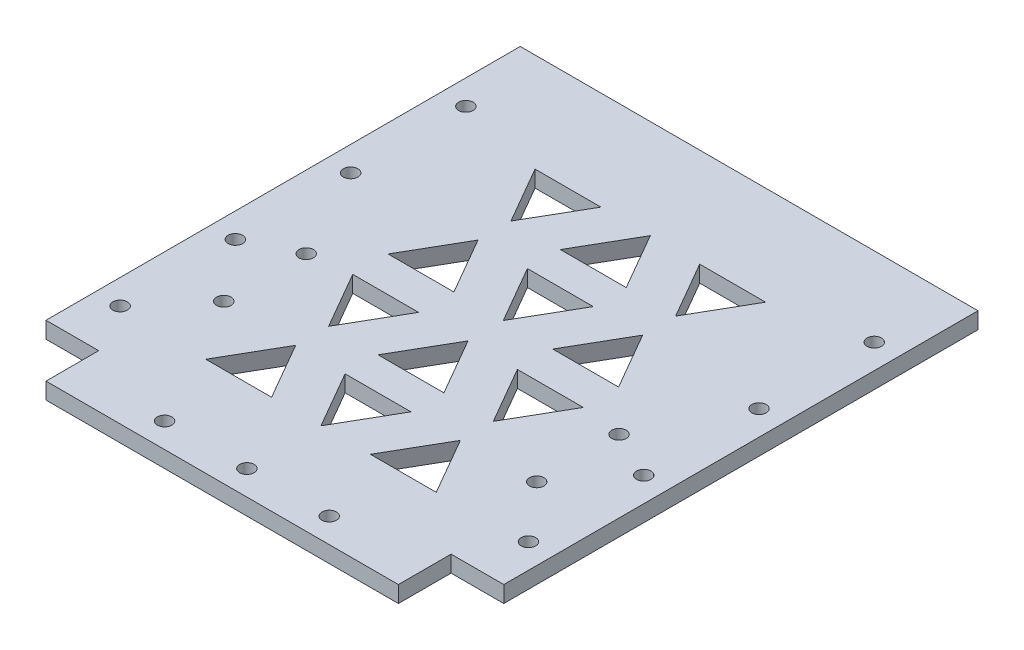
from build123d import *

# Parameters (mm, degrees)
SKETCH1_W               = 139
SKETCH1_H               = 160
BOSS_EXTRUDE1_DEPTH     = 5
SKETCH2_W               = 16
SKETCH2_H               = 16
CUT_EXTRUDE1_DEPTH      = 107.090763029
SKETCH3_R               = 2.2
CUT_EXTRUDE2_DEPTH      = 107.090763029
SKETCH4_R               = 2.2
CUT_EXTRUDE3_DEPTH      = 107.090763029
LPATTERN1_COUNT         = 4
LPATTERN1_PITCH         = 35
MIRROR2_COPY_1_SKETCH_R = 2.2
MIRROR2_COPY_1_DEPTH    = 107.090763029
MIRROR2_COPY_2_SKETCH_R = 2.2
MIRROR2_COPY_2_DEPTH    = 107.090763029
MIRROR2_COPY_3_SKETCH_R = 2.2
MIRROR2_COPY_3_DEPTH    = 107.090763029
SKETCH5_R               = 2.2
CUT_EXTRUDE4_DEPTH      = 107.090763029
CUT_EXTRUDE5_DEPTH      = 107.090763029


with BuildPart() as part:
    # Sketch1 → Boss-Extrude1 (new body)
    with BuildSketch(Plane(origin=(0, 0, 0), x_dir=(1, 0, 0), z_dir=(0, 1, 0))):
        Rectangle(SKETCH1_W, SKETCH1_H)
    extrude(amount=BOSS_EXTRUDE1_DEPTH)

    # Sketch2 → Cut-Extrude1 (cut, through all)
    with BuildSketch(Plane(origin=(0, 5, 0), x_dir=(1, 0, 0), z_dir=(0, 1, 0))):
        with Locations((-61.5, -72)):
            Rectangle(SKETCH2_W, SKETCH2_H)
    cut_extrude1 = extrude(amount=-CUT_EXTRUDE1_DEPTH, mode=Mode.SUBTRACT)

    # Mirror1: Cut-Extrude1 across plane
    add(cut_extrude1.mirror(Plane(origin=(0, 0, 0), x_dir=(0, 0, 1), z_dir=(1, 0, 0))), mode=Mode.SUBTRACT)

    # Sketch3 → Cut-Extrude2 (cut, through all)
    with BuildSketch(Plane(origin=(0, 5, 0), x_dir=(1, 0, 0), z_dir=(0, 1, 0))):
        with Locations(Location((0, -72.5, 0), (0, 0, 270))):
            Circle(SKETCH3_R)
        with Locations(Location((-25, -72.5, 0), (0, 0, 270))):
            Circle(SKETCH3_R)
        with Locations(Location((25, -72.5, 0), (0, 0, 270))):
            Circle(SKETCH3_R)
    extrude(amount=-CUT_EXTRUDE2_DEPTH, mode=Mode.SUBTRACT)

    # Sketch4 → Cut-Extrude3 (cut, through all)
    with BuildSketch(Plane(origin=(0, 5, 0), x_dir=(1, 0, 0), z_dir=(0, 1, 0))):
        with Locations(Location((-62, -49, 0), (0, 0, 270))):
            Circle(SKETCH4_R)
    cut_extrude3 = extrude(amount=-CUT_EXTRUDE3_DEPTH, mode=Mode.SUBTRACT)

    # LPattern1: Cut-Extrude3 ×4
    with Locations(*[(0, 0, -i * LPATTERN1_PITCH) for i in range(1, LPATTERN1_COUNT)]):
        add(cut_extrude3, mode=Mode.SUBTRACT)

    # Mirror2: Cut-Extrude3 across plane
    add(cut_extrude3.mirror(Plane(origin=(0, 0, 0), x_dir=(0, 0, 1), z_dir=(1, 0, 0))), mode=Mode.SUBTRACT)

    # Mirror2 copy 1 sketch → Mirror2 copy 1 (cut, through all)
    with BuildSketch(Plane(origin=(0, 5, -35), x_dir=(-1, 0, 0), z_dir=(0, 1, 0))):
        with Locations((-62, 49)):
            Circle(MIRROR2_COPY_1_SKETCH_R)
    extrude(amount=-MIRROR2_COPY_1_DEPTH, mode=Mode.SUBTRACT)

    # Mirror2 copy 2 sketch → Mirror2 copy 2 (cut, through all)
    with BuildSketch(Plane(origin=(0, 5, -70), x_dir=(-1, 0, 0), z_dir=(0, 1, 0))):
        with Locations((-62, 49)):
            Circle(MIRROR2_COPY_2_SKETCH_R)
    extrude(amount=-MIRROR2_COPY_2_DEPTH, mode=Mode.SUBTRACT)

    # Mirror2 copy 3 sketch → Mirror2 copy 3 (cut, through all)
    with BuildSketch(Plane(origin=(0, 5, -105), x_dir=(-1, 0, 0), z_dir=(0, 1, 0))):
        with Locations((-62, 49)):
            Circle(MIRROR2_COPY_3_SKETCH_R)
    extrude(amount=-MIRROR2_COPY_3_DEPTH, mode=Mode.SUBTRACT)

    # Sketch5 → Cut-Extrude4 (cut, through all)
    with BuildSketch(Plane(origin=(0, 5, 0), x_dir=(1, 0, 0), z_dir=(0, 1, 0))):
        with Locations(Location((-47.5, -32, 0), (0, 0, 270))):
            Circle(SKETCH5_R)
        with Locations(Location((-47.5, -7, 0), (0, 0, 270))):
            Circle(SKETCH5_R)
    cut_extrude4 = extrude(amount=-CUT_EXTRUDE4_DEPTH, mode=Mode.SUBTRACT)

    # Mirror3: Cut-Extrude4 across plane
    add(cut_extrude4.mirror(Plane(origin=(0, 0, 0), x_dir=(0, 0, 1), z_dir=(1, 0, 0))), mode=Mode.SUBTRACT)

    # Sketch6 → Cut-Extrude5 (cut, through all)
    with BuildSketch(Plane(origin=(0, 5, 0), x_dir=(1, 0, 0), z_dir=(0, 1, 0))):
        Polygon((0, 50), (-10, 32.679491924), (10, 32.679491924), align=None)
        Polygon((15, 50), (25, 32.679491924), (35, 50), align=None)
        Polygon((-25, 32.679491924), (-35, 50), (-15, 50), align=None)
        Polygon((25, 22.679491924), (35, 5.358983849), (15, 5.358983849), align=None)
        Polygon((-10, 22.679491924), (10, 22.679491924), (0, 5.358983849), align=None)
        Polygon((-15, 5.358983849), (-25, 22.679491924), (-35, 5.358983849), align=None)
        Polygon((15, -5.358983849), (25, -22.679491924), (35, -5.358983849), align=None)
        Polygon((0, -5.358983849), (-10, -22.679491924), (10, -22.679491924), align=None)
        Polygon((-35, -5.358983849), (-15, -5.358983849), (-25, -22.679491924), align=None)
        Polygon((25, -32.679491924), (35, -50), (15, -50), align=None)
        Polygon((-10, -32.679491924), (10, -32.679491924), (0, -50), align=None)
        Polygon((-15, -50), (-25, -32.679491924), (-35, -50), align=None)
    extrude(amount=-CUT_EXTRUDE5_DEPTH, mode=Mode.SUBTRACT)


solid = part.part
